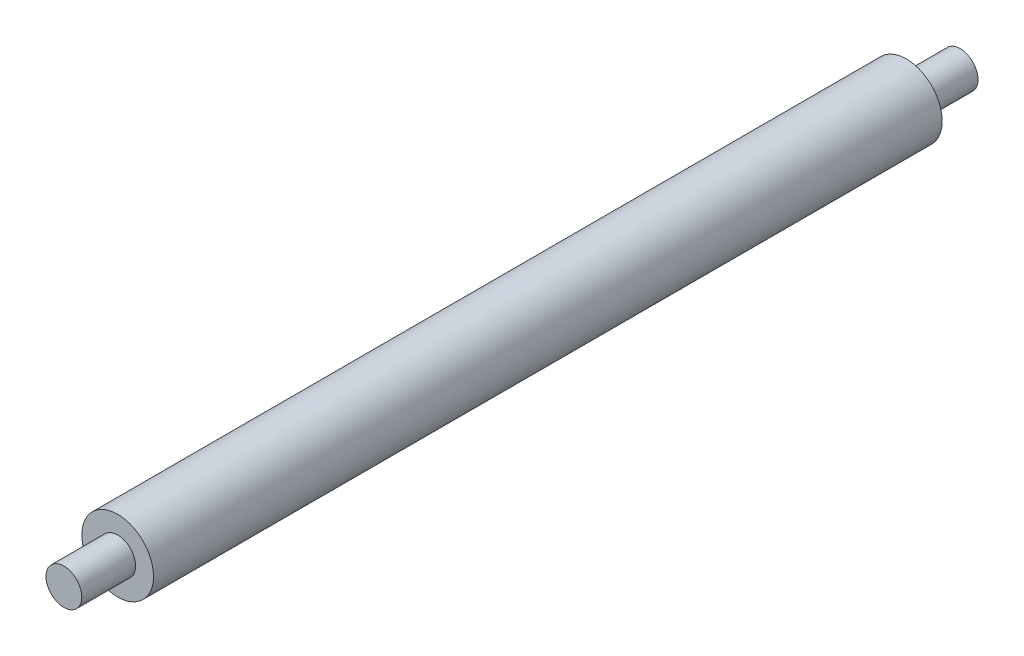
from build123d import *

# Parameters (mm, degrees)
BOSS_EXTRUDE1_DEPTH      = 220
BOSS_EXTRUDE1_DEPTH_BACK = 220
SKETCH2_R                = 20
SKETCH3_R                = 10
BOSS_EXTRUDE2_DEPTH      = 30
BOSS_EXTRUDE3_START      = 30
SKETCH4_R                = 10
BOSS_EXTRUDE3_DEPTH      = 30


with BuildPart() as part:
    # Sketch2 → Boss-Extrude1 (new, two sides: drawn at the far end of the back side and taken through both)
    with BuildSketch(Plane.XY.offset(-BOSS_EXTRUDE1_DEPTH_BACK)):
        Circle(SKETCH2_R)
    extrude(amount=BOSS_EXTRUDE1_DEPTH + BOSS_EXTRUDE1_DEPTH_BACK)

    # Sketch3 → Boss-Extrude2 (add)
    with BuildSketch(Plane.XY.offset(220)):
        Circle(SKETCH3_R)
    extrude(amount=BOSS_EXTRUDE2_DEPTH)

    # Sketch4 → Boss-Extrude3 (add)
    with BuildSketch(Plane(origin=(0, 0, -220), x_dir=(-1, 0, 0), z_dir=(0, 0, -1)).offset(BOSS_EXTRUDE3_START)):
        Circle(SKETCH4_R)
    extrude(amount=-BOSS_EXTRUDE3_DEPTH)


solid = part.part
